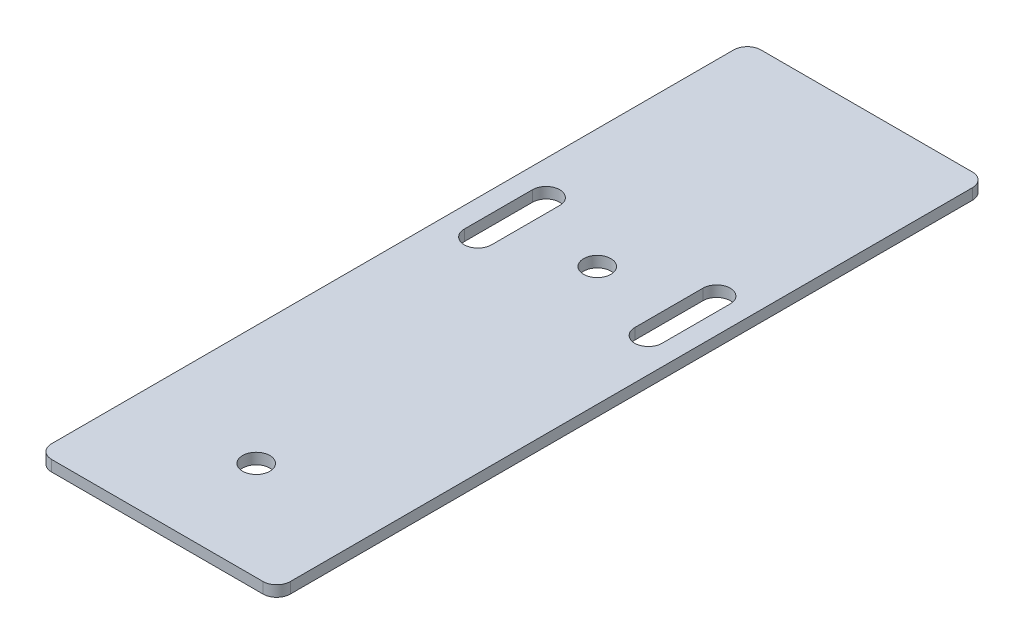
from build123d import *

# Parameters (mm, degrees)
SKETCH_1_W          = 35
SKETCH_1_H          = 104
EXTRUDE_1_DEPTH     = 1.6
SKETCH_3_R          = 2
CUT_EXTRUDE_1_DEPTH = 55.88906995
CUT_EXTRUDE_2_DEPTH = 55.88906995
FILLET_1_R          = 2


with BuildPart() as part:
    # 草图1 → 凸台-拉伸1 (new body)
    with BuildSketch(Plane(origin=(0, 0, 0), x_dir=(1, 0, 0), z_dir=(0, 1, 0))):
        Rectangle(SKETCH_1_W, SKETCH_1_H)
    extrude(amount=EXTRUDE_1_DEPTH)

    # 草图3 → 切除-拉伸1 (cut, through all)
    with BuildSketch(Plane(origin=(0, 1.6, 0), x_dir=(1, 0, 0), z_dir=(0, 1, 0))):
        with Locations(Location((0, 12.5, 0), (0, 0, 270))):
            Circle(SKETCH_3_R)
        with Locations(Location((0, -37.5, 0), (0, 0, 270))):
            Circle(SKETCH_3_R)
    extrude(amount=-CUT_EXTRUDE_1_DEPTH, mode=Mode.SUBTRACT)

    # 草图4 → 切除-拉伸2 (cut, through all)
    with BuildSketch(Plane(origin=(0, 1.6, 0), x_dir=(1, 0, 0), z_dir=(0, 1, 0))):
        with BuildLine():
            Line((10.5, 7.5), (10.5, 17.5))
            ThreePointArc((10.5, 17.5), (12.5, 19.5), (14.5, 17.5))
            Line((14.5, 17.5), (14.5, 7.5))
            ThreePointArc((14.5, 7.5), (12.5, 5.5), (10.5, 7.5))
        make_face()
        with BuildLine():
            Line((-10.5, 7.5), (-10.5, 17.5))
            ThreePointArc((-10.5, 17.5), (-12.5, 19.5), (-14.5, 17.5))
            Line((-14.5, 17.5), (-14.5, 7.5))
            ThreePointArc((-14.5, 7.5), (-12.5, 5.5), (-10.5, 7.5))
        make_face()
    extrude(amount=-CUT_EXTRUDE_2_DEPTH, mode=Mode.SUBTRACT)

    # 圆角1
    fillet_1_edges = [part.edges().sort_by_distance(p)[0] for p in [
        (17.5, 0.8, 52),
        (-17.5, 0.8, 52),
        (-17.5, 0.8, -52),
        (17.5, 0.8, -52),
    ]]
    fillet(fillet_1_edges, radius=FILLET_1_R)


solid = part.part
